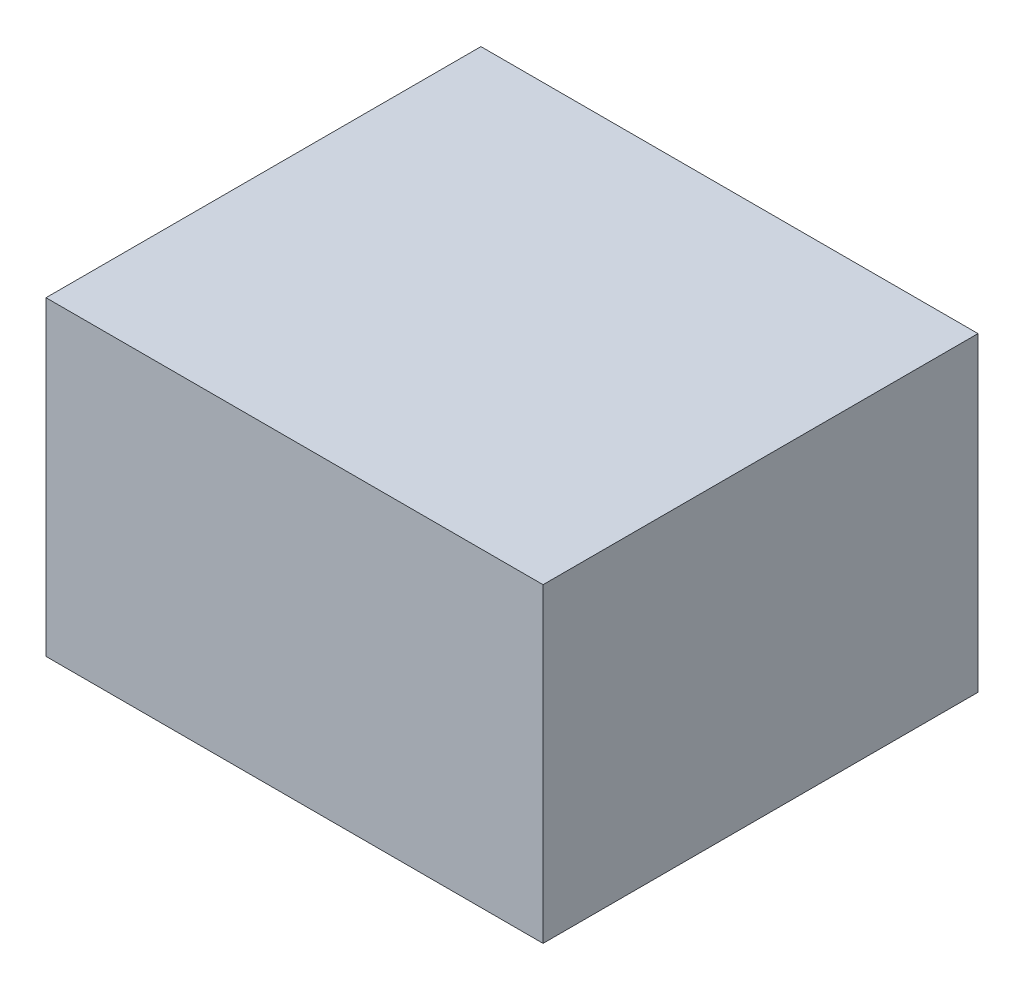
from build123d import *

# Parameters (mm, degrees)
BOSS_EXTRUDE1_START = -1815
SKETCH1_W           = 400
SKETCH1_H           = 250
BOSS_EXTRUDE1_DEPTH = 350


with BuildPart() as part:
    # Sketch1 → Boss-Extrude1 (new body)
    with BuildSketch(Plane.XY.offset(BOSS_EXTRUDE1_START)):
        with Locations((0, -80)):
            Rectangle(SKETCH1_W, SKETCH1_H)
    extrude(amount=BOSS_EXTRUDE1_DEPTH)


solid = part.part
